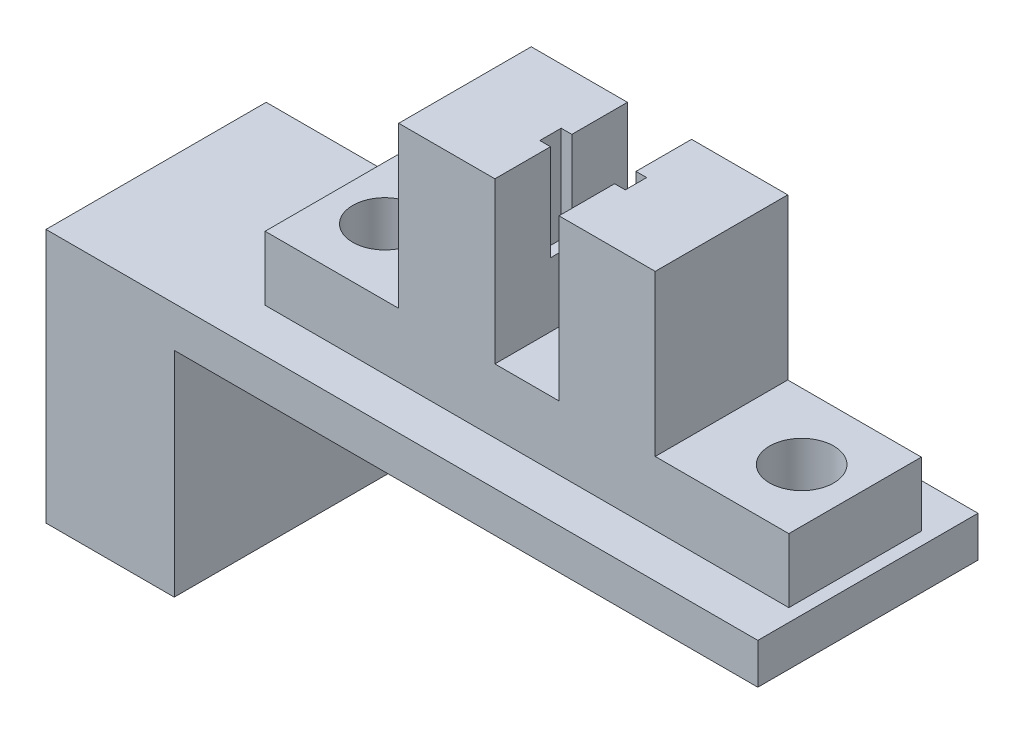
from build123d import *

# Parameters (mm, degrees)
SKETCH1_W                     = 33.3
SKETCH1_H                     = 10.3
BOSS_EXTRUDE1_DEPTH           = 1.9
SKETCH2_W                     = 24.5
SKETCH2_H                     = 6.2
SKETCH2_R                     = 1.5
BOSS_EXTRUDE2_DEPTH           = 3
SKETCH3_W                     = 4.5
SKETCH3_H                     = 6.2
BOSS_EXTRUDE3_DEPTH           = 7.5
SKETCH4_W                     = 6
SKETCH4_H                     = 10.3
BOSS_EXTRUDE4_DEPTH           = 10
SKETCH5_R                     = 1
BOSS_EXTRUDE5_DEPTH           = 2
BOSS_EXTRUDE5_DRAFT           = 22
BOSS_EXTRUDE5_PROFILE_2_DEPTH = 2
BOSS_EXTRUDE5_PROFILE_2_DRAFT = 22
BOSS_EXTRUDE5_PROFILE_3_DEPTH = 2
BOSS_EXTRUDE5_PROFILE_3_DRAFT = 22
BOSS_EXTRUDE5_PROFILE_4_DEPTH = 2
BOSS_EXTRUDE5_PROFILE_4_DRAFT = 22
SKETCH6_W                     = 4
SKETCH6_H                     = 1
CUT_EXTRUDE1_DEPTH            = 4.5
CUT_EXTRUDE2_REACH            = 23.103
SKETCH2_2_R                   = 1.5


with BuildPart() as part:
    # Sketch1 → Boss-Extrude1 (new body)
    with BuildSketch(Plane(origin=(0, 0, 0), x_dir=(1, 0, 0), z_dir=(0, 1, 0))):
        Rectangle(SKETCH1_W, SKETCH1_H)
    extrude(amount=BOSS_EXTRUDE1_DEPTH)

    # Sketch2 → Boss-Extrude2 (add)
    with BuildSketch(Plane(origin=(0, 1.9, 0), x_dir=(1, 0, 0), z_dir=(0, 1, 0))):
        with Locations((3.8, 0)):
            Rectangle(SKETCH2_W, SKETCH2_H)
        with Locations((-5.95, 0)):
            Circle(SKETCH2_R, mode=Mode.SUBTRACT)
        with Locations((13.55, 0)):
            Circle(SKETCH2_R, mode=Mode.SUBTRACT)
    extrude(amount=BOSS_EXTRUDE2_DEPTH)

    # Sketch3 → Boss-Extrude3 (add)
    with BuildSketch(Plane(origin=(0, 4.9, 0), x_dir=(1, 0, 0), z_dir=(0, 1, 0))):
        with Locations((0.05, 0)):
            Rectangle(SKETCH3_W, SKETCH3_H)
        with Locations((7.55, 0)):
            Rectangle(SKETCH3_W, SKETCH3_H)
    extrude(amount=BOSS_EXTRUDE3_DEPTH)

    # Sketch4 → Boss-Extrude4 (add)
    with BuildSketch(Plane.XZ):
        with Locations((-13.65, 0)):
            Rectangle(SKETCH4_W, SKETCH4_H)
    extrude(amount=BOSS_EXTRUDE4_DEPTH)


with BuildPart() as boss_extrude5_tool:
    # Sketch5 → Boss-Extrude5 (with draft: the straight prism first)
    with BuildSketch(Plane.XZ):
        with Locations((-0.925, 1.726795989)):
            Circle(SKETCH5_R)
    extrude(amount=BOSS_EXTRUDE5_DEPTH)
    # Boss-Extrude5: the draft: its side faces are tilted about the plane it starts from
    boss_extrude5_sides = [boss_extrude5_tool.faces().sort_by_distance(p)[0] for p in [
        (-1.925, -1, 1.726795989),
    ]]
    draft(boss_extrude5_sides, Plane.XZ, BOSS_EXTRUDE5_DRAFT)


with BuildPart() as part_1:
    add(part.part)

    # Boss-Extrude5: add boss_extrude5_tool
    add(boss_extrude5_tool.part)


with BuildPart() as boss_extrude5_profile_2_tool:
    # Sketch5 → Boss-Extrude5 profile 2 (with draft: the straight prism first)
    with BuildSketch(Plane.XZ):
        with Locations((-0.925, -0.973204011)):
            Circle(SKETCH5_R)
    extrude(amount=BOSS_EXTRUDE5_PROFILE_2_DEPTH)
    # Boss-Extrude5 profile 2: the draft: its side faces are tilted about the plane it starts from
    boss_extrude5_profile_2_sides = [boss_extrude5_profile_2_tool.faces().sort_by_distance(p)[0] for p in [
        (-1.925, -1, -0.973204011),
    ]]
    draft(boss_extrude5_profile_2_sides, Plane.XZ, BOSS_EXTRUDE5_PROFILE_2_DRAFT)


with BuildPart() as part_2:
    add(part_1.part)

    # Boss-Extrude5 profile 2: add boss_extrude5_profile_2_tool
    add(boss_extrude5_profile_2_tool.part)


with BuildPart() as boss_extrude5_profile_3_tool:
    # Sketch5 → Boss-Extrude5 profile 3 (with draft: the straight prism first)
    with BuildSketch(Plane.XZ):
        with Locations((8.525, -0.973204011)):
            Circle(SKETCH5_R)
    extrude(amount=BOSS_EXTRUDE5_PROFILE_3_DEPTH)
    # Boss-Extrude5 profile 3: the draft: its side faces are tilted about the plane it starts from
    boss_extrude5_profile_3_sides = [boss_extrude5_profile_3_tool.faces().sort_by_distance(p)[0] for p in [
        (7.525, -1, -0.973204011),
    ]]
    draft(boss_extrude5_profile_3_sides, Plane.XZ, BOSS_EXTRUDE5_PROFILE_3_DRAFT)


with BuildPart() as part_3:
    add(part_2.part)

    # Boss-Extrude5 profile 3: add boss_extrude5_profile_3_tool
    add(boss_extrude5_profile_3_tool.part)


with BuildPart() as boss_extrude5_profile_4_tool:
    # Sketch5 → Boss-Extrude5 profile 4 (with draft: the straight prism first)
    with BuildSketch(Plane.XZ):
        with Locations((8.525, 1.726795989)):
            Circle(SKETCH5_R)
    extrude(amount=BOSS_EXTRUDE5_PROFILE_4_DEPTH)
    # Boss-Extrude5 profile 4: the draft: its side faces are tilted about the plane it starts from
    boss_extrude5_profile_4_sides = [boss_extrude5_profile_4_tool.faces().sort_by_distance(p)[0] for p in [
        (7.525, -1, 1.726795989),
    ]]
    draft(boss_extrude5_profile_4_sides, Plane.XZ, BOSS_EXTRUDE5_PROFILE_4_DRAFT)


with BuildPart() as part_4:
    add(part_3.part)

    # Boss-Extrude5 profile 4: add boss_extrude5_profile_4_tool
    add(boss_extrude5_profile_4_tool.part)

    # Sketch6 → Cut-Extrude1 (cut)
    with BuildSketch(Plane(origin=(0, 12.4, 0), x_dir=(1, 0, 0), z_dir=(0, 1, 0))):
        with Locations((3.8, 0)):
            Rectangle(SKETCH6_W, SKETCH6_H)
    extrude(amount=-CUT_EXTRUDE1_DEPTH, mode=Mode.SUBTRACT)

    # Sketch2<2> → Cut-Extrude2 (cut, up to next)
    with BuildSketch(Plane(origin=(0, 1.9, 0), x_dir=(1, 0, 0), z_dir=(0, 1, 0)), mode=Mode.PRIVATE) as cut_extrude2_sk1:
        with Locations((-5.95, 0)):
            Circle(SKETCH2_2_R)
    cut_extrude2_tool1 = extrude(cut_extrude2_sk1.sketch, amount=-CUT_EXTRUDE2_REACH, mode=Mode.PRIVATE) & part_4.part
    # Sketch2<2> → Cut-Extrude2 (cut, up to next)
    with BuildSketch(Plane(origin=(0, 1.9, 0), x_dir=(1, 0, 0), z_dir=(0, 1, 0)), mode=Mode.PRIVATE) as cut_extrude2_sk2:
        with Locations((13.55, 0)):
            Circle(SKETCH2_2_R)
    cut_extrude2_tool2 = extrude(cut_extrude2_sk2.sketch, amount=-CUT_EXTRUDE2_REACH, mode=Mode.PRIVATE) & part_4.part
    add(cut_extrude2_tool1.solids().sort_by_distance((-5.95, 1.9, 0))[0], mode=Mode.SUBTRACT)
    add(cut_extrude2_tool2.solids().sort_by_distance((13.55, 1.9, 0))[0], mode=Mode.SUBTRACT)


solid = part_4.part
